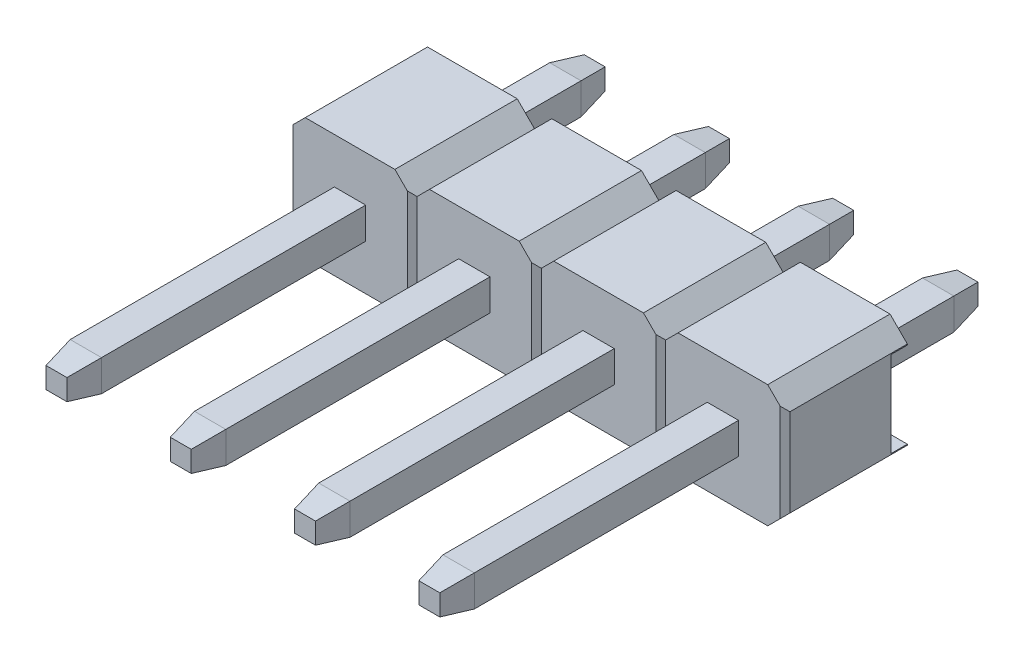
from build123d import *
from OCP.BRepFilletAPI import BRepFilletAPI_MakeChamfer

# Parameters (mm, degrees)
EXTRUDE1_DEPTH          = 1.25
CUT_EXTRUDE3_DEPTH      = 3.176671771
LPATTERN4_COUNT         = 4
LPATTERN4_PITCH         = 2.54
CUT_EXTRUDE1_DEPTH      = 10.064055384
CUT_EXTRUDE1_DEPTH_BACK = 10.064055384
SKETCH2_W               = 1.752893218
SKETCH2_H               = 0.33
SKETCH3_W               = 11
SKETCH3_H               = 0.64
EXTRUDE_THIN1_DEPTH     = 0.32
LPATTERN5_COUNT         = 5
LPATTERN5_PITCH         = 2.54
CHAMFER2_SIZE           = 0.6
CHAMFER2_SIZE2          = 0.105796188


with BuildPart() as part:
    # Sketch1 → Extrude1 (new, symmetric)
    with BuildSketch(Plane.XY):
        Polygon((-1.27, 0.896446609), (-0.916446609, 1.25), (0.916446609, 1.25), (1.27, 0.896446609), (1.27, -0.896446609), (0.916446609, -1.25), (-0.916446609, -1.25), (-1.27, -0.896446609), align=None)
    extrude1 = extrude(amount=EXTRUDE1_DEPTH, both=True)

    # Sketch4 → Cut-Extrude3 (cut, symmetric)
    with BuildSketch(Plane(origin=(0, 0, 0), x_dir=(1, 0, 0), z_dir=(0, 1, 0))):
        Polygon((-1.27, -1.15), (-1.17, -1.25), (-1.27, -1.25), align=None)
        Polygon((1.17, -1.25), (1.27, -1.15), (1.27, -1.25), align=None)
    cut_extrude3 = extrude(amount=CUT_EXTRUDE3_DEPTH, both=True, mode=Mode.SUBTRACT)

    # LPattern4: Extrude1, Cut-Extrude3 ×4
    with Locations(*[(-i * LPATTERN4_PITCH, 0, 0) for i in range(1, LPATTERN4_COUNT)]):
        add(extrude1)
        add(cut_extrude3, mode=Mode.SUBTRACT)

    # Sketch2 → Cut-Extrude1 (cut, two sides: drawn at the far end of the back side and taken through both)
    with BuildSketch(Plane(origin=(0, 0, 0), x_dir=(0, -1, 0), z_dir=(1, 0, 0)).offset(-CUT_EXTRUDE1_DEPTH_BACK)):
        with Locations((0, 1.085)):
            Rectangle(SKETCH2_W, SKETCH2_H)
    extrude(amount=CUT_EXTRUDE1_DEPTH + CUT_EXTRUDE1_DEPTH_BACK, mode=Mode.SUBTRACT)

    # Sketch3 → Extrude-Thin1 (add, symmetric)
    with BuildSketch(Plane(origin=(0, 0, 0), x_dir=(0, 0, -1), z_dir=(1, 0, 0))):
        with Locations((-1.75, 0)):
            Rectangle(SKETCH3_W, SKETCH3_H)
    extrude_thin1 = extrude(amount=EXTRUDE_THIN1_DEPTH, both=True)

    # LPattern5: Extrude-Thin1 ×5, 1 skipped
    with Locations(*[(-i * LPATTERN5_PITCH, 0, 0) for i in range(1, LPATTERN5_COUNT) if i not in (4,)]):
        add(extrude_thin1)

    # Chamfer2: one chamfer whose edges measure the first distance from different faces: ONE call of the kernel's chamfer builder (chamfer() names one face for all edges)
    chamfer2_edges_1 = [part.edges().sort_by_distance(p)[0] for p in [
        (0, -0.32, 7.25),
    ]]
    chamfer2_side_1 = [part.faces().sort_by_distance(p)[0] for p in [
        (0, -0.32, 4.25),
    ]]
    chamfer2_edges_2 = [part.edges().sort_by_distance(p)[0] for p in [
        (0, 0.32, -3.75),
    ]]
    chamfer2_side_2 = [part.faces().sort_by_distance(p)[0] for p in [
        (0, 0.32, -2.335),
    ]]
    chamfer2_edges_3 = [part.edges().sort_by_distance(p)[0] for p in [
        (-0.32, 0, 7.25),
    ]]
    chamfer2_side_3 = [part.faces().sort_by_distance(p)[0] for p in [
        (-0.32, 0, 4.25),
    ]]
    chamfer2_edges_4 = [part.edges().sort_by_distance(p)[0] for p in [
        (-0.32, 0, -3.75),
    ]]
    chamfer2_side_4 = [part.faces().sort_by_distance(p)[0] for p in [
        (-0.32, 0, -2.335),
    ]]
    chamfer2_edges_5 = [part.edges().sort_by_distance(p)[0] for p in [
        (0, -0.32, -3.75),
    ]]
    chamfer2_side_5 = [part.faces().sort_by_distance(p)[0] for p in [
        (0, -0.32, -2.335),
    ]]
    chamfer2_edges_6 = [part.edges().sort_by_distance(p)[0] for p in [
        (0.32, 0, -3.75),
    ]]
    chamfer2_side_6 = [part.faces().sort_by_distance(p)[0] for p in [
        (0.32, 0, -2.335),
    ]]
    chamfer2_edges_7 = [part.edges().sort_by_distance(p)[0] for p in [
        (0, 0.32, 7.25),
    ]]
    chamfer2_side_7 = [part.faces().sort_by_distance(p)[0] for p in [
        (0, 0.32, 4.25),
    ]]
    chamfer2_edges_8 = [part.edges().sort_by_distance(p)[0] for p in [
        (0.32, 0, 7.25),
    ]]
    chamfer2_side_8 = [part.faces().sort_by_distance(p)[0] for p in [
        (0.32, 0, 4.25),
    ]]
    chamfer2_edges_9 = [part.edges().sort_by_distance(p)[0] for p in [
        (-2.54, -0.32, 7.25),
    ]]
    chamfer2_side_9 = [part.faces().sort_by_distance(p)[0] for p in [
        (-2.54, -0.32, 4.25),
    ]]
    chamfer2_edges_10 = [part.edges().sort_by_distance(p)[0] for p in [
        (-2.54, 0.32, -3.75),
    ]]
    chamfer2_side_10 = [part.faces().sort_by_distance(p)[0] for p in [
        (-2.54, 0.32, -2.335),
    ]]
    chamfer2_edges_11 = [part.edges().sort_by_distance(p)[0] for p in [
        (-2.86, 0, -3.75),
    ]]
    chamfer2_side_11 = [part.faces().sort_by_distance(p)[0] for p in [
        (-2.86, 0, -2.335),
    ]]
    chamfer2_edges_12 = [part.edges().sort_by_distance(p)[0] for p in [
        (-2.86, 0, 7.25),
    ]]
    chamfer2_side_12 = [part.faces().sort_by_distance(p)[0] for p in [
        (-2.86, 0, 4.25),
    ]]
    chamfer2_edges_13 = [part.edges().sort_by_distance(p)[0] for p in [
        (-2.54, -0.32, -3.75),
    ]]
    chamfer2_side_13 = [part.faces().sort_by_distance(p)[0] for p in [
        (-2.54, -0.32, -2.335),
    ]]
    chamfer2_edges_14 = [part.edges().sort_by_distance(p)[0] for p in [
        (-2.22, 0, -3.75),
    ]]
    chamfer2_side_14 = [part.faces().sort_by_distance(p)[0] for p in [
        (-2.22, 0, -2.335),
    ]]
    chamfer2_edges_15 = [part.edges().sort_by_distance(p)[0] for p in [
        (-2.54, 0.32, 7.25),
    ]]
    chamfer2_side_15 = [part.faces().sort_by_distance(p)[0] for p in [
        (-2.54, 0.32, 4.25),
    ]]
    chamfer2_edges_16 = [part.edges().sort_by_distance(p)[0] for p in [
        (-2.22, 0, 7.25),
    ]]
    chamfer2_side_16 = [part.faces().sort_by_distance(p)[0] for p in [
        (-2.22, 0, 4.25),
    ]]
    chamfer2_edges_17 = [part.edges().sort_by_distance(p)[0] for p in [
        (-5.08, -0.32, 7.25),
    ]]
    chamfer2_side_17 = [part.faces().sort_by_distance(p)[0] for p in [
        (-5.08, -0.32, 4.25),
    ]]
    chamfer2_edges_18 = [part.edges().sort_by_distance(p)[0] for p in [
        (-5.08, 0.32, -3.75),
    ]]
    chamfer2_side_18 = [part.faces().sort_by_distance(p)[0] for p in [
        (-5.08, 0.32, -2.335),
    ]]
    chamfer2_edges_19 = [part.edges().sort_by_distance(p)[0] for p in [
        (-5.4, 0, -3.75),
    ]]
    chamfer2_side_19 = [part.faces().sort_by_distance(p)[0] for p in [
        (-5.4, 0, -2.335),
    ]]
    chamfer2_edges_20 = [part.edges().sort_by_distance(p)[0] for p in [
        (-5.4, 0, 7.25),
    ]]
    chamfer2_side_20 = [part.faces().sort_by_distance(p)[0] for p in [
        (-5.4, 0, 4.25),
    ]]
    chamfer2_edges_21 = [part.edges().sort_by_distance(p)[0] for p in [
        (-5.08, -0.32, -3.75),
    ]]
    chamfer2_side_21 = [part.faces().sort_by_distance(p)[0] for p in [
        (-5.08, -0.32, -2.335),
    ]]
    chamfer2_edges_22 = [part.edges().sort_by_distance(p)[0] for p in [
        (-4.76, 0, -3.75),
    ]]
    chamfer2_side_22 = [part.faces().sort_by_distance(p)[0] for p in [
        (-4.76, 0, -2.335),
    ]]
    chamfer2_edges_23 = [part.edges().sort_by_distance(p)[0] for p in [
        (-5.08, 0.32, 7.25),
    ]]
    chamfer2_side_23 = [part.faces().sort_by_distance(p)[0] for p in [
        (-5.08, 0.32, 4.25),
    ]]
    chamfer2_edges_24 = [part.edges().sort_by_distance(p)[0] for p in [
        (-4.76, 0, 7.25),
    ]]
    chamfer2_side_24 = [part.faces().sort_by_distance(p)[0] for p in [
        (-4.76, 0, 4.25),
    ]]
    chamfer2_edges_25 = [part.edges().sort_by_distance(p)[0] for p in [
        (-7.62, -0.32, 7.25),
    ]]
    chamfer2_side_25 = [part.faces().sort_by_distance(p)[0] for p in [
        (-7.62, -0.32, 4.25),
    ]]
    chamfer2_edges_26 = [part.edges().sort_by_distance(p)[0] for p in [
        (-7.62, 0.32, -3.75),
    ]]
    chamfer2_side_26 = [part.faces().sort_by_distance(p)[0] for p in [
        (-7.62, 0.32, -2.335),
    ]]
    chamfer2_edges_27 = [part.edges().sort_by_distance(p)[0] for p in [
        (-7.94, 0, -3.75),
    ]]
    chamfer2_side_27 = [part.faces().sort_by_distance(p)[0] for p in [
        (-7.94, 0, -2.335),
    ]]
    chamfer2_edges_28 = [part.edges().sort_by_distance(p)[0] for p in [
        (-7.94, 0, 7.25),
    ]]
    chamfer2_side_28 = [part.faces().sort_by_distance(p)[0] for p in [
        (-7.94, 0, 4.25),
    ]]
    chamfer2_edges_29 = [part.edges().sort_by_distance(p)[0] for p in [
        (-7.62, -0.32, -3.75),
    ]]
    chamfer2_side_29 = [part.faces().sort_by_distance(p)[0] for p in [
        (-7.62, -0.32, -2.335),
    ]]
    chamfer2_edges_30 = [part.edges().sort_by_distance(p)[0] for p in [
        (-7.3, 0, -3.75),
    ]]
    chamfer2_side_30 = [part.faces().sort_by_distance(p)[0] for p in [
        (-7.3, 0, -2.335),
    ]]
    chamfer2_edges_31 = [part.edges().sort_by_distance(p)[0] for p in [
        (-7.62, 0.32, 7.25),
    ]]
    chamfer2_side_31 = [part.faces().sort_by_distance(p)[0] for p in [
        (-7.62, 0.32, 4.25),
    ]]
    chamfer2_edges_32 = [part.edges().sort_by_distance(p)[0] for p in [
        (-7.3, 0, 7.25),
    ]]
    chamfer2_side_32 = [part.faces().sort_by_distance(p)[0] for p in [
        (-7.3, 0, 4.25),
    ]]
    chamfer2 = BRepFilletAPI_MakeChamfer(part.part.solid().wrapped)
    for e in chamfer2_edges_1:
        chamfer2.Add(CHAMFER2_SIZE, CHAMFER2_SIZE2, e.wrapped, chamfer2_side_1[0].wrapped)  # the first distance lies on this face
    for e in chamfer2_edges_2:
        chamfer2.Add(CHAMFER2_SIZE, CHAMFER2_SIZE2, e.wrapped, chamfer2_side_2[0].wrapped)  # the first distance lies on this face
    for e in chamfer2_edges_3:
        chamfer2.Add(CHAMFER2_SIZE, CHAMFER2_SIZE2, e.wrapped, chamfer2_side_3[0].wrapped)  # the first distance lies on this face
    for e in chamfer2_edges_4:
        chamfer2.Add(CHAMFER2_SIZE, CHAMFER2_SIZE2, e.wrapped, chamfer2_side_4[0].wrapped)  # the first distance lies on this face
    for e in chamfer2_edges_5:
        chamfer2.Add(CHAMFER2_SIZE, CHAMFER2_SIZE2, e.wrapped, chamfer2_side_5[0].wrapped)  # the first distance lies on this face
    for e in chamfer2_edges_6:
        chamfer2.Add(CHAMFER2_SIZE, CHAMFER2_SIZE2, e.wrapped, chamfer2_side_6[0].wrapped)  # the first distance lies on this face
    for e in chamfer2_edges_7:
        chamfer2.Add(CHAMFER2_SIZE, CHAMFER2_SIZE2, e.wrapped, chamfer2_side_7[0].wrapped)  # the first distance lies on this face
    for e in chamfer2_edges_8:
        chamfer2.Add(CHAMFER2_SIZE, CHAMFER2_SIZE2, e.wrapped, chamfer2_side_8[0].wrapped)  # the first distance lies on this face
    for e in chamfer2_edges_9:
        chamfer2.Add(CHAMFER2_SIZE, CHAMFER2_SIZE2, e.wrapped, chamfer2_side_9[0].wrapped)  # the first distance lies on this face
    for e in chamfer2_edges_10:
        chamfer2.Add(CHAMFER2_SIZE, CHAMFER2_SIZE2, e.wrapped, chamfer2_side_10[0].wrapped)  # the first distance lies on this face
    for e in chamfer2_edges_11:
        chamfer2.Add(CHAMFER2_SIZE, CHAMFER2_SIZE2, e.wrapped, chamfer2_side_11[0].wrapped)  # the first distance lies on this face
    for e in chamfer2_edges_12:
        chamfer2.Add(CHAMFER2_SIZE, CHAMFER2_SIZE2, e.wrapped, chamfer2_side_12[0].wrapped)  # the first distance lies on this face
    for e in chamfer2_edges_13:
        chamfer2.Add(CHAMFER2_SIZE, CHAMFER2_SIZE2, e.wrapped, chamfer2_side_13[0].wrapped)  # the first distance lies on this face
    for e in chamfer2_edges_14:
        chamfer2.Add(CHAMFER2_SIZE, CHAMFER2_SIZE2, e.wrapped, chamfer2_side_14[0].wrapped)  # the first distance lies on this face
    for e in chamfer2_edges_15:
        chamfer2.Add(CHAMFER2_SIZE, CHAMFER2_SIZE2, e.wrapped, chamfer2_side_15[0].wrapped)  # the first distance lies on this face
    for e in chamfer2_edges_16:
        chamfer2.Add(CHAMFER2_SIZE, CHAMFER2_SIZE2, e.wrapped, chamfer2_side_16[0].wrapped)  # the first distance lies on this face
    for e in chamfer2_edges_17:
        chamfer2.Add(CHAMFER2_SIZE, CHAMFER2_SIZE2, e.wrapped, chamfer2_side_17[0].wrapped)  # the first distance lies on this face
    for e in chamfer2_edges_18:
        chamfer2.Add(CHAMFER2_SIZE, CHAMFER2_SIZE2, e.wrapped, chamfer2_side_18[0].wrapped)  # the first distance lies on this face
    for e in chamfer2_edges_19:
        chamfer2.Add(CHAMFER2_SIZE, CHAMFER2_SIZE2, e.wrapped, chamfer2_side_19[0].wrapped)  # the first distance lies on this face
    for e in chamfer2_edges_20:
        chamfer2.Add(CHAMFER2_SIZE, CHAMFER2_SIZE2, e.wrapped, chamfer2_side_20[0].wrapped)  # the first distance lies on this face
    for e in chamfer2_edges_21:
        chamfer2.Add(CHAMFER2_SIZE, CHAMFER2_SIZE2, e.wrapped, chamfer2_side_21[0].wrapped)  # the first distance lies on this face
    for e in chamfer2_edges_22:
        chamfer2.Add(CHAMFER2_SIZE, CHAMFER2_SIZE2, e.wrapped, chamfer2_side_22[0].wrapped)  # the first distance lies on this face
    for e in chamfer2_edges_23:
        chamfer2.Add(CHAMFER2_SIZE, CHAMFER2_SIZE2, e.wrapped, chamfer2_side_23[0].wrapped)  # the first distance lies on this face
    for e in chamfer2_edges_24:
        chamfer2.Add(CHAMFER2_SIZE, CHAMFER2_SIZE2, e.wrapped, chamfer2_side_24[0].wrapped)  # the first distance lies on this face
    for e in chamfer2_edges_25:
        chamfer2.Add(CHAMFER2_SIZE, CHAMFER2_SIZE2, e.wrapped, chamfer2_side_25[0].wrapped)  # the first distance lies on this face
    for e in chamfer2_edges_26:
        chamfer2.Add(CHAMFER2_SIZE, CHAMFER2_SIZE2, e.wrapped, chamfer2_side_26[0].wrapped)  # the first distance lies on this face
    for e in chamfer2_edges_27:
        chamfer2.Add(CHAMFER2_SIZE, CHAMFER2_SIZE2, e.wrapped, chamfer2_side_27[0].wrapped)  # the first distance lies on this face
    for e in chamfer2_edges_28:
        chamfer2.Add(CHAMFER2_SIZE, CHAMFER2_SIZE2, e.wrapped, chamfer2_side_28[0].wrapped)  # the first distance lies on this face
    for e in chamfer2_edges_29:
        chamfer2.Add(CHAMFER2_SIZE, CHAMFER2_SIZE2, e.wrapped, chamfer2_side_29[0].wrapped)  # the first distance lies on this face
    for e in chamfer2_edges_30:
        chamfer2.Add(CHAMFER2_SIZE, CHAMFER2_SIZE2, e.wrapped, chamfer2_side_30[0].wrapped)  # the first distance lies on this face
    for e in chamfer2_edges_31:
        chamfer2.Add(CHAMFER2_SIZE, CHAMFER2_SIZE2, e.wrapped, chamfer2_side_31[0].wrapped)  # the first distance lies on this face
    for e in chamfer2_edges_32:
        chamfer2.Add(CHAMFER2_SIZE, CHAMFER2_SIZE2, e.wrapped, chamfer2_side_32[0].wrapped)  # the first distance lies on this face
    add(Compound.cast(chamfer2.Shape()), mode=Mode.REPLACE)


solid = part.part
